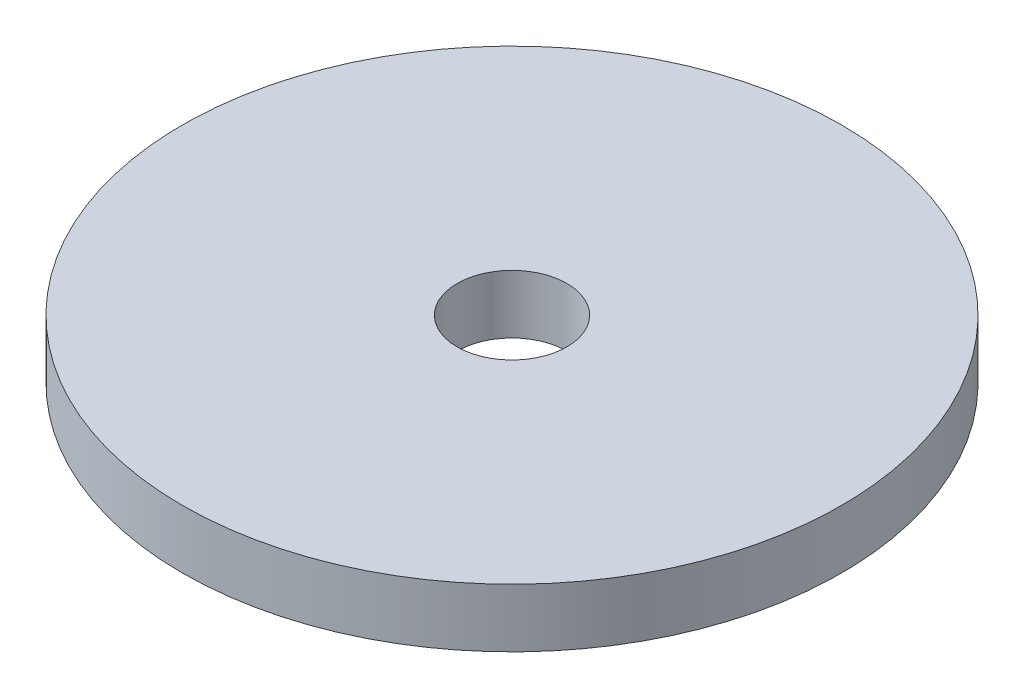
from build123d import *

# Parameters (mm, degrees)
SKETCH1_R           = 22.5
SKETCH1_R_2         = 3.75
BOSS_EXTRUDE1_DEPTH = 4


with BuildPart() as part:
    # Sketch1 → Boss-Extrude1 (new body)
    with BuildSketch(Plane(origin=(0, 0, 0), x_dir=(1, 0, 0), z_dir=(0, 1, 0))):
        with Locations(Location((0, 0, 0), (0, 0, 270))):
            Circle(SKETCH1_R)
        with Locations(Location((0, 0, 0), (0, 0, 270))):
            Circle(SKETCH1_R_2, mode=Mode.SUBTRACT)
    extrude(amount=BOSS_EXTRUDE1_DEPTH)


solid = part.part
